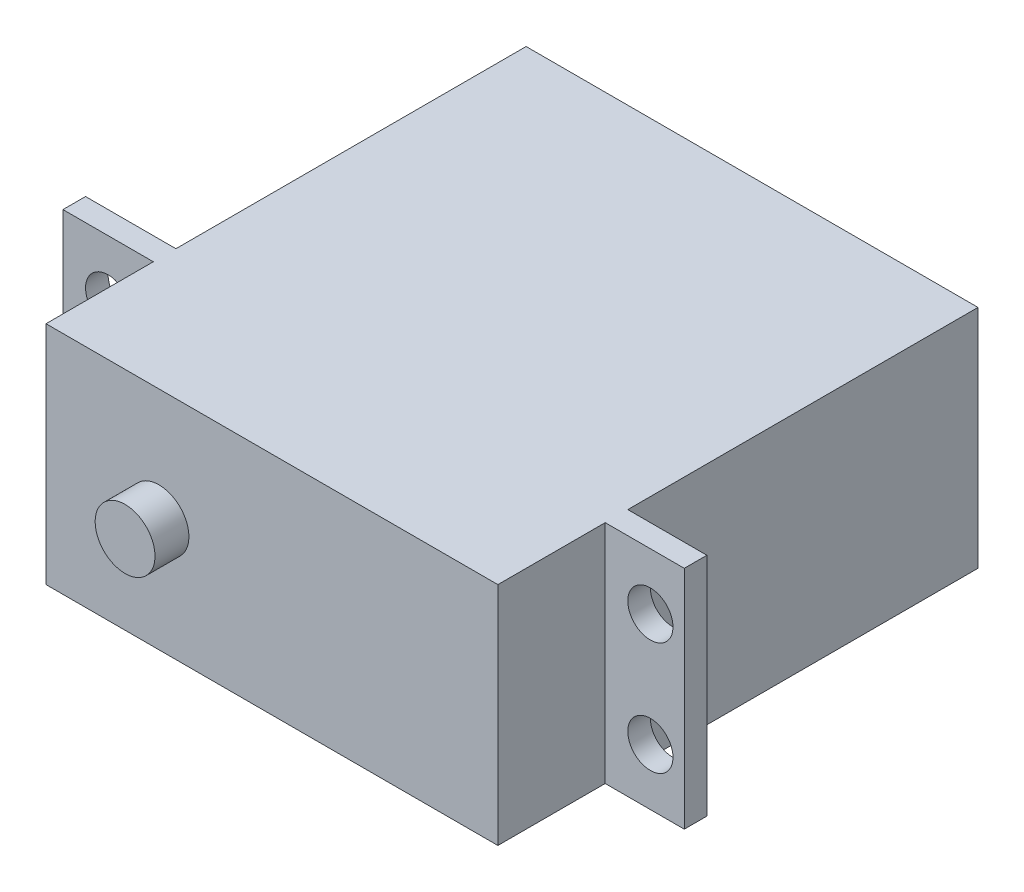
from build123d import *

# Parameters (mm, degrees)
ESQUISSE1_W             = 40
ESQUISSE1_H             = 20
BOSS_EXTRU_1_DEPTH      = 42.5
BOSS_EXTRU_2_DEPTH      = 7
BOSS_EXTRU_2_DEPTH_BACK = 48
ESQUISSE2_W             = 2
ESQUISSE2_H             = 20
ESQUISSE3_R             = 2
ENL_V_MAT_EXTRU_1_DEPTH = 7.5
ESQUISSE5_R             = 2.65
BOSS_EXTRU_3_DEPTH      = 3


with BuildPart() as part:
    # Esquisse1 → Boss.-Extru.1 (new body)
    with BuildSketch(Plane.XY):
        with Locations((10, 0)):
            Rectangle(ESQUISSE1_W, ESQUISSE1_H)
    extrude(amount=-BOSS_EXTRU_1_DEPTH)

    # Esquisse2 → Boss.-Extru.2 (add, two sides: drawn at the far end of the back side and taken through both)
    with BuildSketch(Plane(origin=(30, 0, 0), x_dir=(0, 0, -1), z_dir=(1, 0, 0)).offset(-BOSS_EXTRU_2_DEPTH_BACK)):
        with Locations((10.5, 0)):
            Rectangle(ESQUISSE2_W, ESQUISSE2_H)
    extrude(amount=BOSS_EXTRU_2_DEPTH + BOSS_EXTRU_2_DEPTH_BACK)

    # Esquisse3 → Enlèv. mat.-Extru.1 (cut)
    with BuildSketch(Plane(origin=(0, 0, -11.5), x_dir=(-1, 0, 0), z_dir=(0, 0, -1))):
        with Locations(Location((14, 5, 0), (0, 0, 270))):
            Circle(ESQUISSE3_R)
        with Locations((14, -5)):
            Circle(ESQUISSE3_R)
        with Locations(Location((-34, -5, 0), (0, 0, 270))):
            Circle(ESQUISSE3_R)
        with Locations((-34, 5)):
            Circle(ESQUISSE3_R)
    extrude(amount=-ENL_V_MAT_EXTRU_1_DEPTH, mode=Mode.SUBTRACT)

    # Esquisse5 → Boss.-Extru.3 (add)
    with BuildSketch(Plane(origin=(0, 0, 0), x_dir=(-1, 0, 0), z_dir=(0, 0, -1))):
        Circle(ESQUISSE5_R)
    extrude(amount=-BOSS_EXTRU_3_DEPTH)


solid = part.part
